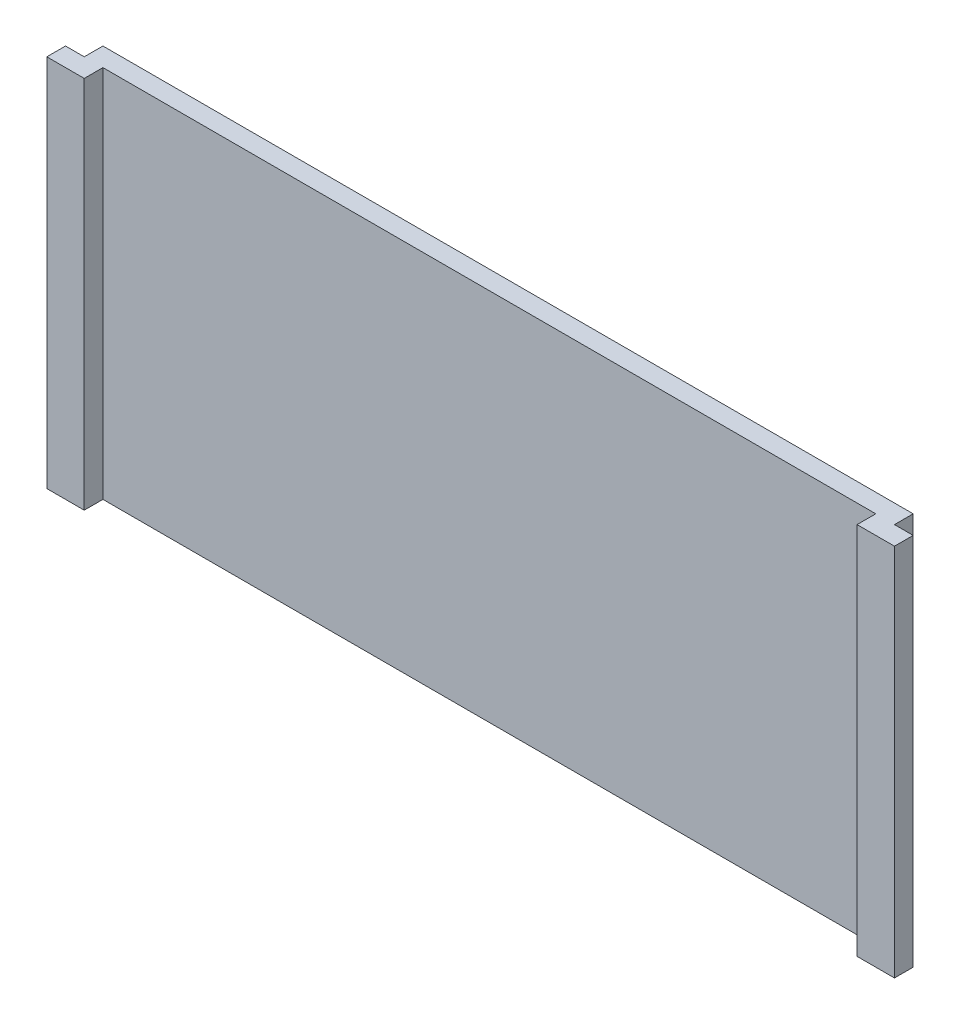
from build123d import *

# Parameters (mm, degrees)
SKETCH_1_W      = 130
SKETCH_1_H      = 60
EXTRUDE_1_DEPTH = 3
SKETCH_2_W      = 3
SKETCH_2_H      = 60
EXTRUDE_2_DEPTH = 3


with BuildPart() as part:
    # 草圖1 → 填料-伸長1 (new body)
    with BuildSketch(Plane.XY):
        with Locations((51.235306675, 18.734939759)):
            Rectangle(SKETCH_1_W, SKETCH_1_H)
    extrude(amount=EXTRUDE_1_DEPTH)

    # 草圖2 → 填料-伸長2 (add)
    with BuildSketch(Plane.XY.offset(3)):
        with Locations((-15.264693325, 18.734939759)):
            Rectangle(SKETCH_2_W, SKETCH_2_H)
        with Locations((-12.264693325, 18.734939759)):
            Rectangle(SKETCH_2_W, SKETCH_2_H)
        with Locations((117.735306675, 18.734939759)):
            Rectangle(SKETCH_2_W, SKETCH_2_H)
        with Locations((114.735306675, 18.734939759)):
            Rectangle(SKETCH_2_W, SKETCH_2_H)
    extrude(amount=EXTRUDE_2_DEPTH)


solid = part.part
